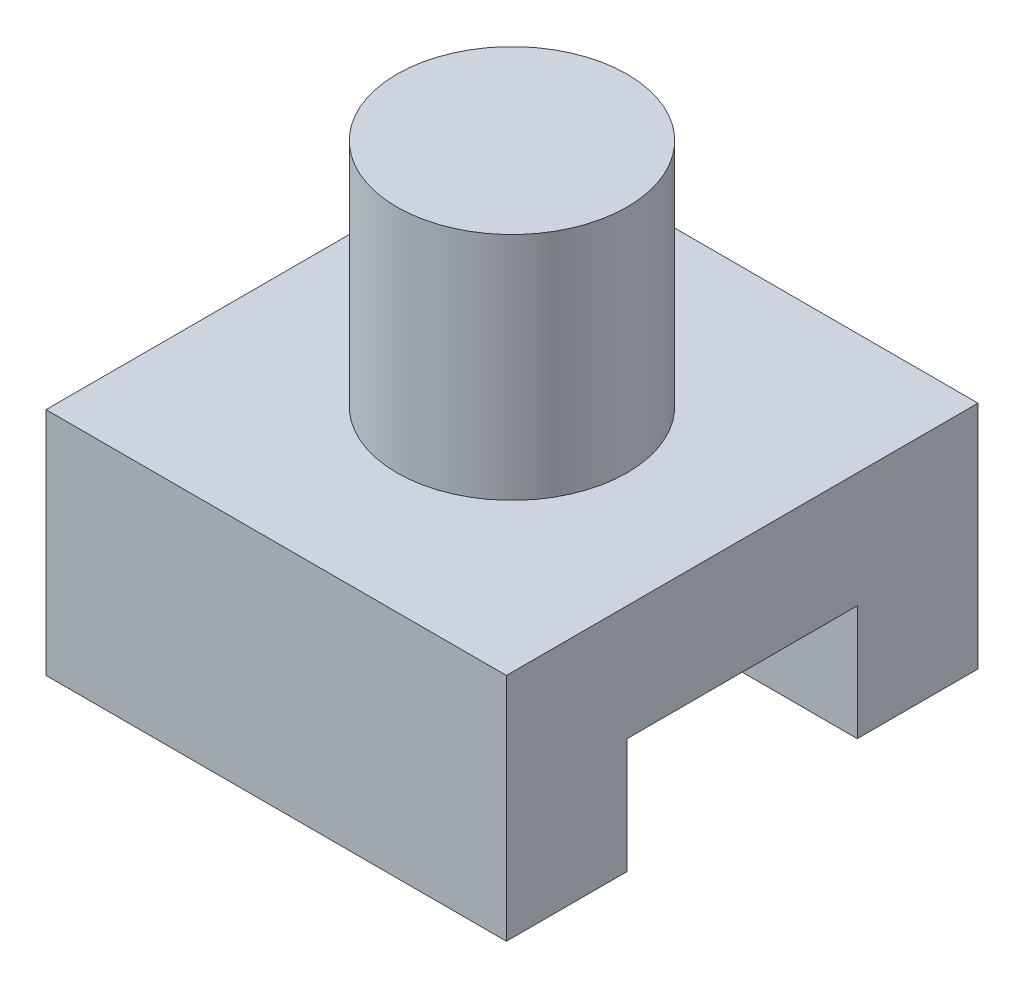
from build123d import *

# Parameters (mm, degrees)
BOSS_EXTRUDE1_DEPTH = 101.6
SKETCH2_R           = 25.4
BOSS_EXTRUDE2_DEPTH = 50.8


with BuildPart() as part:
    # Sketch1 → Boss-Extrude1 (new body)
    with BuildSketch(Plane(origin=(0, 0, 0), x_dir=(0, 0, -1), z_dir=(1, 0, 0))):
        Polygon((-25.4, 0), (-25.4, -25.4), (-52.03902439, -25.4), (-52.03902439, 25.4), (52.03902439, 25.4), (52.03902439, -25.4), (25.4, -25.4), (25.4, 0), align=None)
    extrude(amount=BOSS_EXTRUDE1_DEPTH)

    # Sketch2 → Boss-Extrude2 (add)
    with BuildSketch(Plane(origin=(0, 25.4, 0), x_dir=(1, 0, 0), z_dir=(0, 1, 0))):
        with Locations(Location((50.8, 0, 0), (0, 0, 270))):
            Circle(SKETCH2_R)
    extrude(amount=BOSS_EXTRUDE2_DEPTH)


solid = part.part
